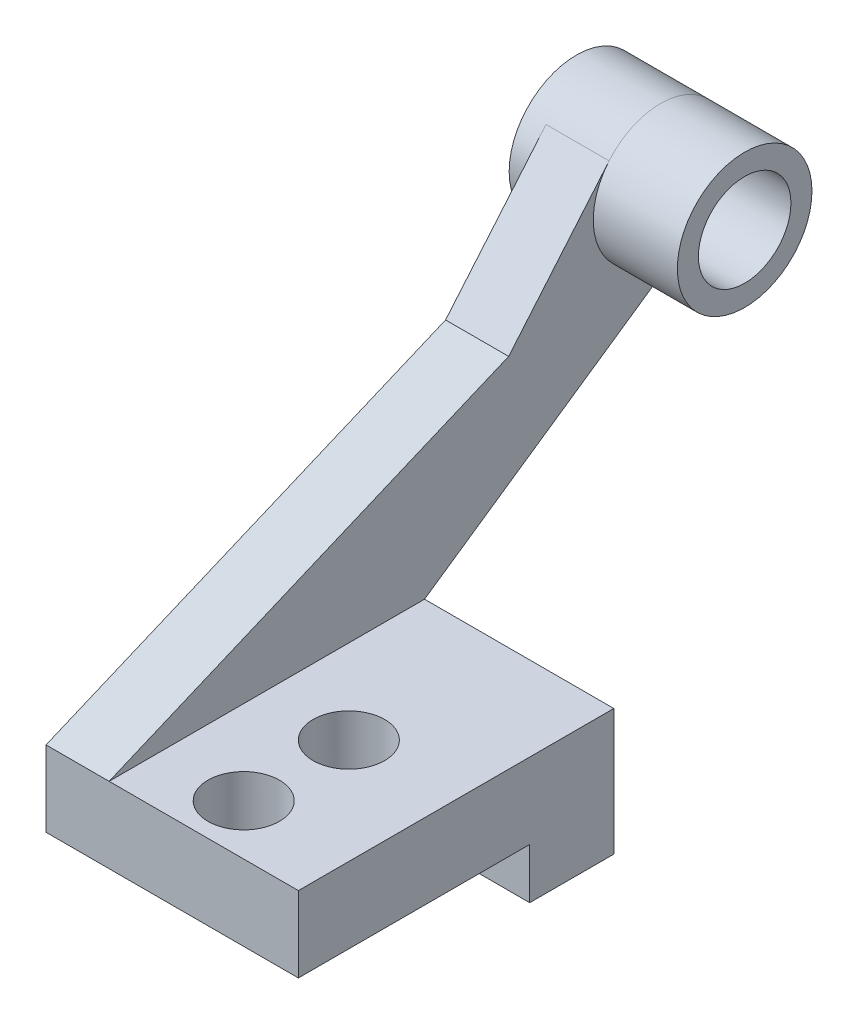
from build123d import *

# Parameters (mm, degrees)
BOSS_EXTRUDE1_DEPTH = 60
BOSS_EXTRUDE2_DEPTH = 15
SKETCH3_R           = 16.002353199
SKETCH3_R_2         = 11
BOSS_EXTRUDE3_DEPTH = 20
BOSS_EXTRUDE4_START = 5
SKETCH4_R           = 16
SKETCH4_R_2         = 11
BOSS_EXTRUDE4_DEPTH = 5
SKETCH5_R           = 11
CUT_EXTRUDE2_DEPTH  = 157.074401446
SKETCH6_R           = 8.5
CUT_EXTRUDE3_DEPTH  = 154.528935617


with BuildPart() as part:
    # Sketch1 → Boss-Extrude1 (new body)
    with BuildSketch(Plane(origin=(0, 0, 0), x_dir=(0, 0, -1), z_dir=(1, 0, 0))):
        Polygon((-29.344624104, 0), (-29.344624104, 18), (45.655375896, 18), (45.655375896, -12), (25.655375896, -12), (25.655375896, 0), align=None)
    extrude(amount=-BOSS_EXTRUDE1_DEPTH)

    # Sketch2 → Boss-Extrude2 (add)
    with BuildSketch(Plane.ZY.offset(60)):
        with BuildLine():
            Line((-45.655375896, 18), (29.344624104, 18))
            Line((29.344624104, 18), (-65.655375896, 58))
            Line((-65.655375896, 58), (-89.536995268, 86.31551376))
            ThreePointArc((-89.536995268, 86.31551376), (-113.623611479, 86.744179795), (-110.833026428, 62.815923064))
            Line((-110.833026428, 62.815923064), (-45.655375896, 18))
        make_face()
    extrude(amount=-BOSS_EXTRUDE2_DEPTH)

    # Sketch3 → Boss-Extrude3 (add)
    with BuildSketch(Plane(origin=(-45, 0, 0), x_dir=(0, 0, -1), z_dir=(1, 0, 0))):
        with Locations(Location((101.767701538, 76, 0), (0, 0, 140.837952037))):
            Circle(SKETCH3_R)
        with Locations((101.767701538, 76)):
            Circle(SKETCH3_R_2, mode=Mode.SUBTRACT)
    extrude(amount=BOSS_EXTRUDE3_DEPTH)

    # Sketch4 → Boss-Extrude4 (add)
    with BuildSketch(Plane.ZY.offset(60).offset(BOSS_EXTRUDE4_START)):
        with Locations((-101.767701538, 76)):
            Circle(SKETCH4_R)
        with Locations(Location((-101.767701538, 76, 0), (0, 0, 180))):
            Circle(SKETCH4_R_2, mode=Mode.SUBTRACT)
    extrude(amount=-BOSS_EXTRUDE4_DEPTH)

    # Sketch5 → Cut-Extrude2 (cut, through all)
    with BuildSketch(Plane(origin=(-45, 0, 0), x_dir=(0, 0, -1), z_dir=(1, 0, 0))):
        with Locations(Location((101.767701538, 76, 0), (0, 0, 180))):
            Circle(SKETCH5_R)
    extrude(amount=-CUT_EXTRUDE2_DEPTH, mode=Mode.SUBTRACT)

    # Sketch6 → Cut-Extrude3 (cut, through all)
    with BuildSketch(Plane(origin=(0, 18, 0), x_dir=(1, 0, 0), z_dir=(0, 1, 0))):
        with Locations(Location((-25, -17.344624104, 0), (0, 0, 270))):
            Circle(SKETCH6_R)
        with Locations(Location((-25, 7.655375896, 0), (0, 0, 270))):
            Circle(SKETCH6_R)
    extrude(amount=-CUT_EXTRUDE3_DEPTH, mode=Mode.SUBTRACT)


solid = part.part
